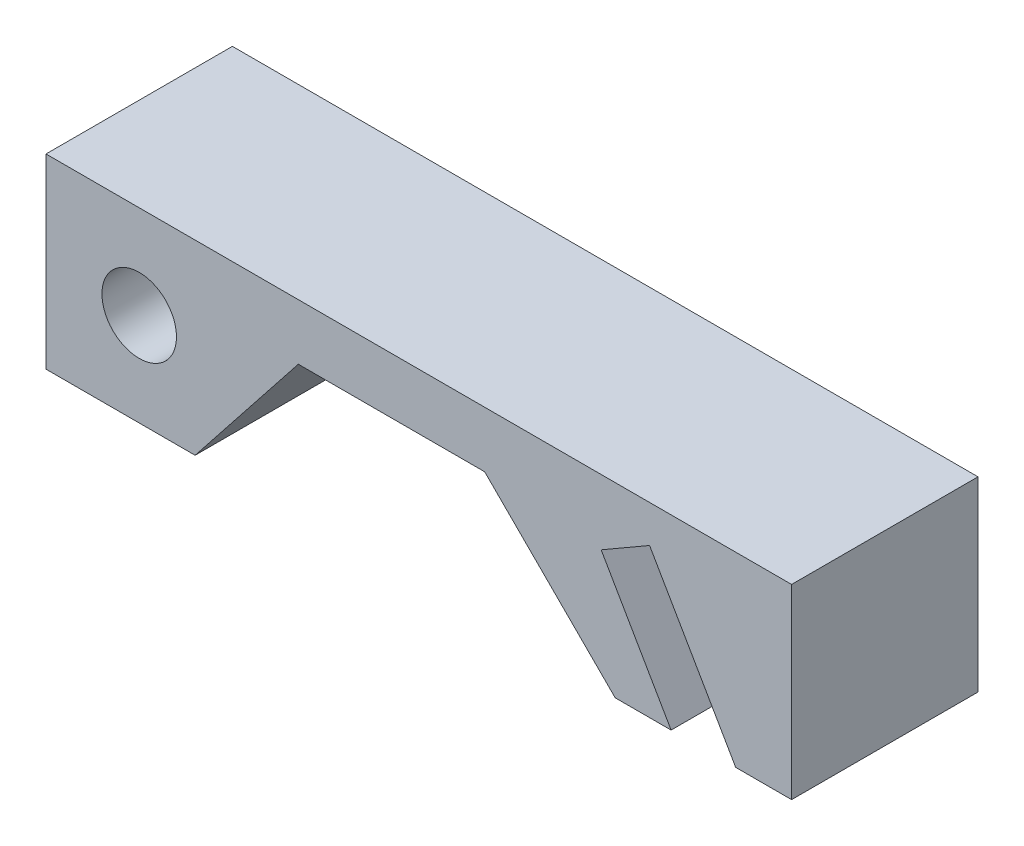
from build123d import *

# Parameters (mm, degrees)
SKETCH2_R           = 2.54
BOSS_EXTRUDE1_DEPTH = 6.35


with BuildPart() as part:
    # Sketch2 → Boss-Extrude1 (new, symmetric)
    with BuildSketch(Plane.XY):
        Polygon((0, 0), (0, 12.7), (50.8, 12.7), (50.8, 0), (46.99, 0), (41.124121265, 10.16), (37.824564477, 8.255), (42.590590949, 0), (38.780590949, 0), (29.890590949, 8.89), (17.190590949, 8.89), (10.16, 0), align=None)
        with Locations((6.35, 6.35)):
            Circle(SKETCH2_R, mode=Mode.SUBTRACT)
    extrude(amount=BOSS_EXTRUDE1_DEPTH, both=True)


solid = part.part
